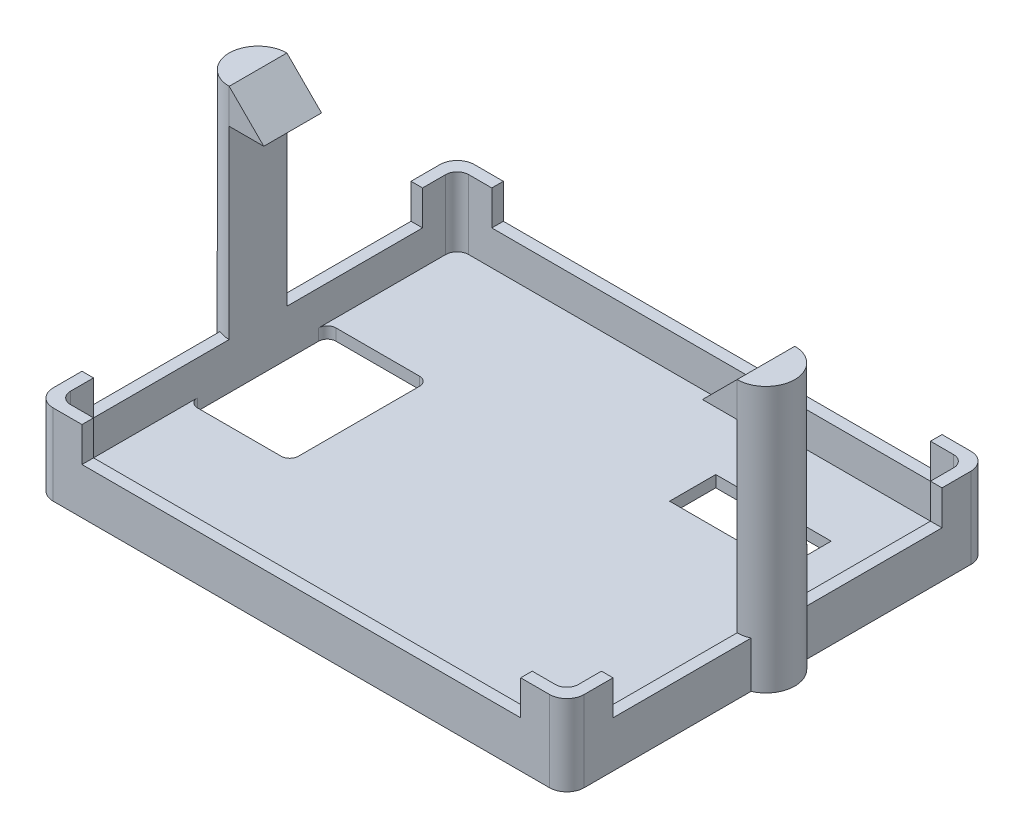
from build123d import *

# Parameters (mm, degrees)
SKETCH1_W           = 10
SKETCH1_H           = 4
BOSS_EXTRUDE1_DEPTH = 1
SKETCH1_3_W         = 38
SKETCH1_3_H         = 1
BOSS_EXTRUDE2_DEPTH = 4
BOSS_EXTRUDE3_DEPTH = 23
SKETCH2_W           = 5
SKETCH2_H           = 3
BOSS_EXTRUDE4_DEPTH = 3
CUT_EXTRUDE1_DEPTH  = 56.873182297
BOSS_EXTRUDE5_DEPTH = 7
BOSS_EXTRUDE8_DEPTH = 23
SKETCH6_W           = 5
SKETCH6_H           = 3
BOSS_EXTRUDE9_DEPTH = 3
CUT_EXTRUDE3_DEPTH  = 56.873182297


with BuildPart() as part:
    # Sketch1 → Boss-Extrude1 (new body)
    with BuildSketch(Plane(origin=(0, 0, 0), x_dir=(1, 0, 0), z_dir=(0, 1, 0))):
        with BuildLine():
            Line((8.75, 22.5), (8.75, 12))
            ThreePointArc((8.75, 12), (8.530330086, 11.469669914), (8, 11.25))
            Line((8, 11.25), (0.75, 11.25))
            ThreePointArc((0.75, 11.25), (0.219669914, 11.469669914), (0, 12))
            Line((0, 12), (0, 1))
            ThreePointArc((0, 1), (0.292893219, 0.292893219), (1, 0))
            Line((1, 0), (43, 0))
            ThreePointArc((43, 0), (43.707106781, 0.292893219), (44, 1))
            Line((44, 1), (44, 33.5))
            ThreePointArc((44, 33.5), (43.707106781, 34.207106781), (43, 34.5))
            Line((43, 34.5), (1, 34.5))
            ThreePointArc((1, 34.5), (0.292893219, 34.207106781), (0, 33.5))
            Line((0, 33.5), (0, 22.5))
            ThreePointArc((0, 22.5), (0.219669914, 23.030330086), (0.75, 23.25))
            Line((0.75, 23.25), (8, 23.25))
            ThreePointArc((8, 23.25), (8.530330086, 23.030330086), (8.75, 22.5))
        make_face()
        with Locations((33.2, 26.7)):
            Rectangle(SKETCH1_W, SKETCH1_H, mode=Mode.SUBTRACT)
    extrude(amount=BOSS_EXTRUDE1_DEPTH)

    # Sketch1<3> → Boss-Extrude2 (add)
    # profile 1 of 12: a face of its own
    with BuildSketch(Plane(origin=(0, 0, 0), x_dir=(1, 0, 0), z_dir=(0, 1, 0))):
        with BuildLine():
            ThreePointArc((43.5, 35.5), (44.560660172, 35.060660172), (45, 34))
            Line((45, 34), (45, 0.5))
            ThreePointArc((45, 0.5), (44.560660172, -0.560660172), (43.5, -1))
            Line((43.5, -1), (0.5, -1))
            ThreePointArc((0.5, -1), (-0.560660172, -0.560660172), (-1, 0.5))
            Line((-1, 0.5), (-1, 34))
            ThreePointArc((-1, 34), (-0.560660172, 35.060660172), (0.5, 35.5))
            Line((0.5, 35.5), (43.5, 35.5))
        make_face()
        with BuildLine():
            ThreePointArc((1, 34.5), (0.292893219, 34.207106781), (0, 33.5))
            Line((0, 33.5), (0, 24.75))
            Line((0, 24.75), (0, 22.5))
            Line((0, 22.5), (0, 12))
            Line((0, 12), (0, 9.75))
            Line((0, 9.75), (0, 1))
            ThreePointArc((0, 1), (0.292893219, 0.292893219), (1, 0))
            Line((1, 0), (43, 0))
            ThreePointArc((43, 0), (43.707106781, 0.292893219), (44, 1))
            Line((44, 1), (44, 33.5))
            ThreePointArc((44, 33.5), (43.707106781, 34.207106781), (43, 34.5))
            Line((43, 34.5), (1, 34.5))
        make_face(mode=Mode.SUBTRACT)
    # profile 2 of 12: a face of its own
    with BuildSketch(Plane(origin=(0, 0, 0), x_dir=(1, 0, 0), z_dir=(0, 1, 0))):
        with BuildLine():
            Line((3, 0), (1, 0))
            ThreePointArc((1, 0), (0.292893219, 0.292893219), (0, 1))
            Line((0, 1), (0, 3))
            Line((0, 3), (-1, 3))
            Line((-1, 3), (-1, 0.5))
            ThreePointArc((-1, 0.5), (-0.560660172, -0.560660172), (0.5, -1))
            Line((0.5, -1), (3, -1))
            Line((3, -1), (3, 0))
        make_face()
    # profile 3 of 12: a face of its own
    with BuildSketch(Plane(origin=(0, 0, 0), x_dir=(1, 0, 0), z_dir=(0, 1, 0))):
        with Locations((22, -0.5)):
            Rectangle(SKETCH1_3_W, SKETCH1_3_H)
    # profile 4 of 12: a face of its own
    with BuildSketch(Plane(origin=(0, 0, 0), x_dir=(1, 0, 0), z_dir=(0, 1, 0))):
        with BuildLine():
            Line((43, 0), (41, 0))
            Line((41, 0), (41, -1))
            Line((41, -1), (43.5, -1))
            ThreePointArc((43.5, -1), (44.560660172, -0.560660172), (45, 0.5))
            Line((45, 0.5), (45, 3))
            Line((45, 3), (44, 3))
            Line((44, 3), (44, 1))
            ThreePointArc((44, 1), (43.707106781, 0.292893219), (43, 0))
        make_face()
    # profile 5 of 12: a face of its own
    with BuildSketch(Plane(origin=(0, 0, 0), x_dir=(1, 0, 0), z_dir=(0, 1, 0))):
        with BuildLine():
            Line((44, 14.75), (44, 3))
            Line((44, 3), (45, 3))
            Line((45, 3), (45, 14.958712153))
            ThreePointArc((45, 14.958712153), (44.510774109, 14.802734218), (44, 14.75))
        make_face()
    # profile 6 of 12: a face of its own
    with BuildSketch(Plane(origin=(0, 0, 0), x_dir=(1, 0, 0), z_dir=(0, 1, 0))):
        with BuildLine():
            Line((44, 31.5), (44, 19.75))
            ThreePointArc((44, 19.75), (44.510774109, 19.697265782), (45, 19.541287847))
            Line((45, 19.541287847), (45, 31.5))
            Line((45, 31.5), (44, 31.5))
        make_face()
    # profile 7 of 12: a face of its own
    with BuildSketch(Plane(origin=(0, 0, 0), x_dir=(1, 0, 0), z_dir=(0, 1, 0))):
        with BuildLine():
            Line((44, 19.75), (44, 14.75))
            ThreePointArc((44, 14.75), (44.510774109, 14.802734218), (45, 14.958712153))
            Line((45, 14.958712153), (45, 19.541287847))
            ThreePointArc((45, 19.541287847), (44.510774109, 19.697265782), (44, 19.75))
        make_face()
    # profile 8 of 12: a face of its own
    with BuildSketch(Plane(origin=(0, 0, 0), x_dir=(1, 0, 0), z_dir=(0, 1, 0))):
        with BuildLine():
            Line((44, 33.5), (44, 31.5))
            Line((44, 31.5), (45, 31.5))
            Line((45, 31.5), (45, 34))
            ThreePointArc((45, 34), (44.560660172, 35.060660172), (43.5, 35.5))
            Line((43.5, 35.5), (41, 35.5))
            Line((41, 35.5), (41, 34.5))
            Line((41, 34.5), (43, 34.5))
            ThreePointArc((43, 34.5), (43.707106781, 34.207106781), (44, 33.5))
        make_face()
    # profile 9 of 12: a face of its own
    with BuildSketch(Plane(origin=(0, 0, 0), x_dir=(1, 0, 0), z_dir=(0, 1, 0))):
        with Locations((22, 35)):
            Rectangle(SKETCH1_3_W, SKETCH1_3_H)
    # profile 10 of 12: a face of its own
    with BuildSketch(Plane(origin=(0, 0, 0), x_dir=(1, 0, 0), z_dir=(0, 1, 0))):
        with BuildLine():
            Line((-1, 34), (-1, 31.5))
            Line((-1, 31.5), (0, 31.5))
            Line((0, 31.5), (0, 33.5))
            ThreePointArc((0, 33.5), (0.292893219, 34.207106781), (1, 34.5))
            Line((1, 34.5), (3, 34.5))
            Line((3, 34.5), (3, 35.5))
            Line((3, 35.5), (0.5, 35.5))
            ThreePointArc((0.5, 35.5), (-0.560660172, 35.060660172), (-1, 34))
        make_face()
    # profile 11 of 12: a face of its own
    with BuildSketch(Plane(origin=(0, 0, 0), x_dir=(1, 0, 0), z_dir=(0, 1, 0))):
        with BuildLine():
            Line((-1, 3), (0, 3))
            Line((0, 3), (0, 9.75))
            Line((0, 9.75), (0, 12))
            Line((0, 12), (0, 14.75))
            ThreePointArc((0, 14.75), (-0.510774109, 14.802734218), (-1, 14.958712153))
            Line((-1, 14.958712153), (-1, 3))
        make_face()
    # profile 12 of 12: a face of its own
    with BuildSketch(Plane(origin=(0, 0, 0), x_dir=(1, 0, 0), z_dir=(0, 1, 0))):
        with BuildLine():
            Line((-1, 31.5), (-1, 19.541287847))
            ThreePointArc((-1, 19.541287847), (-0.510774109, 19.697265782), (0, 19.75))
            Line((0, 19.75), (0, 22.5))
            Line((0, 22.5), (0, 24.75))
            Line((0, 24.75), (0, 31.5))
            Line((0, 31.5), (-1, 31.5))
        make_face()
    extrude(amount=BOSS_EXTRUDE2_DEPTH)

    # Sketch1<4> → Boss-Extrude3 (add)
    with BuildSketch(Plane(origin=(0, 0, 0), x_dir=(1, 0, 0), z_dir=(0, 1, 0))):
        with BuildLine():
            Line((45, 19.541287847), (45, 14.958712153))
            ThreePointArc((45, 14.958712153), (46.5, 17.25), (45, 19.541287847))
        make_face()
        with BuildLine():
            Line((44, 19.75), (44, 14.75))
            ThreePointArc((44, 14.75), (44.510774109, 14.802734218), (45, 14.958712153))
            Line((45, 14.958712153), (45, 19.541287847))
            ThreePointArc((45, 19.541287847), (44.510774109, 19.697265782), (44, 19.75))
        make_face()
    extrude(amount=BOSS_EXTRUDE3_DEPTH)

    # Sketch2 → Boss-Extrude4 (add)
    with BuildSketch(Plane.ZY.offset(-44)):
        with Locations((-17.25, 21.5)):
            Rectangle(SKETCH2_W, SKETCH2_H)
    extrude(amount=BOSS_EXTRUDE4_DEPTH)

    # Sketch3 → Cut-Extrude1 (cut, through all)
    with BuildSketch(Plane.XY.offset(-14.75)):
        Polygon((41, 20), (44, 23), (41, 23), align=None)
    extrude(amount=-CUT_EXTRUDE1_DEPTH, mode=Mode.SUBTRACT)

    # Sketch1<6> → Boss-Extrude5 (add)
    with BuildSketch(Plane(origin=(0, 0, 0), x_dir=(1, 0, 0), z_dir=(0, 1, 0))):
        with BuildLine():
            Line((-1, 34), (-1, 31.5))
            Line((-1, 31.5), (0, 31.5))
            Line((0, 31.5), (0, 33.5))
            ThreePointArc((0, 33.5), (0.292893219, 34.207106781), (1, 34.5))
            Line((1, 34.5), (3, 34.5))
            Line((3, 34.5), (3, 35.5))
            Line((3, 35.5), (0.5, 35.5))
            ThreePointArc((0.5, 35.5), (-0.560660172, 35.060660172), (-1, 34))
        make_face()
        with BuildLine():
            Line((3, 0), (1, 0))
            ThreePointArc((1, 0), (0.292893219, 0.292893219), (0, 1))
            Line((0, 1), (0, 3))
            Line((0, 3), (-1, 3))
            Line((-1, 3), (-1, 0.5))
            ThreePointArc((-1, 0.5), (-0.560660172, -0.560660172), (0.5, -1))
            Line((0.5, -1), (3, -1))
            Line((3, -1), (3, 0))
        make_face()
        with BuildLine():
            Line((43, 0), (41, 0))
            Line((41, 0), (41, -1))
            Line((41, -1), (43.5, -1))
            ThreePointArc((43.5, -1), (44.560660172, -0.560660172), (45, 0.5))
            Line((45, 0.5), (45, 3))
            Line((45, 3), (44, 3))
            Line((44, 3), (44, 1))
            ThreePointArc((44, 1), (43.707106781, 0.292893219), (43, 0))
        make_face()
        with BuildLine():
            Line((44, 33.5), (44, 31.5))
            Line((44, 31.5), (45, 31.5))
            Line((45, 31.5), (45, 34))
            ThreePointArc((45, 34), (44.560660172, 35.060660172), (43.5, 35.5))
            Line((43.5, 35.5), (41, 35.5))
            Line((41, 35.5), (41, 34.5))
            Line((41, 34.5), (43, 34.5))
            ThreePointArc((43, 34.5), (43.707106781, 34.207106781), (44, 33.5))
        make_face()
    extrude(amount=BOSS_EXTRUDE5_DEPTH)

    # Sketch1<9> → Boss-Extrude8 (add)
    with BuildSketch(Plane(origin=(0, 0, 0), x_dir=(1, 0, 0), z_dir=(0, 1, 0))):
        with BuildLine():
            ThreePointArc((-1, 19.541287847), (-2.5, 17.25), (-1, 14.958712153))
            Line((-1, 14.958712153), (-1, 19.541287847))
        make_face()
        with BuildLine():
            Line((-1, 19.541287847), (-1, 14.958712153))
            ThreePointArc((-1, 14.958712153), (-0.510774109, 14.802734218), (0, 14.75))
            Line((0, 14.75), (0, 19.75))
            ThreePointArc((0, 19.75), (-0.510774109, 19.697265782), (-1, 19.541287847))
        make_face()
    extrude(amount=BOSS_EXTRUDE8_DEPTH)

    # Sketch6 → Boss-Extrude9 (add)
    with BuildSketch(Plane(origin=(0, 0, 0), x_dir=(0, 0, -1), z_dir=(1, 0, 0))):
        with Locations((17.25, 21.5)):
            Rectangle(SKETCH6_W, SKETCH6_H)
    extrude(amount=BOSS_EXTRUDE9_DEPTH)

    # Sketch7 → Cut-Extrude3 (cut, through all)
    with BuildSketch(Plane.XY.offset(-14.75)):
        Polygon((3, 23), (3, 20), (0, 23), align=None)
    extrude(amount=-CUT_EXTRUDE3_DEPTH, mode=Mode.SUBTRACT)


solid = part.part
